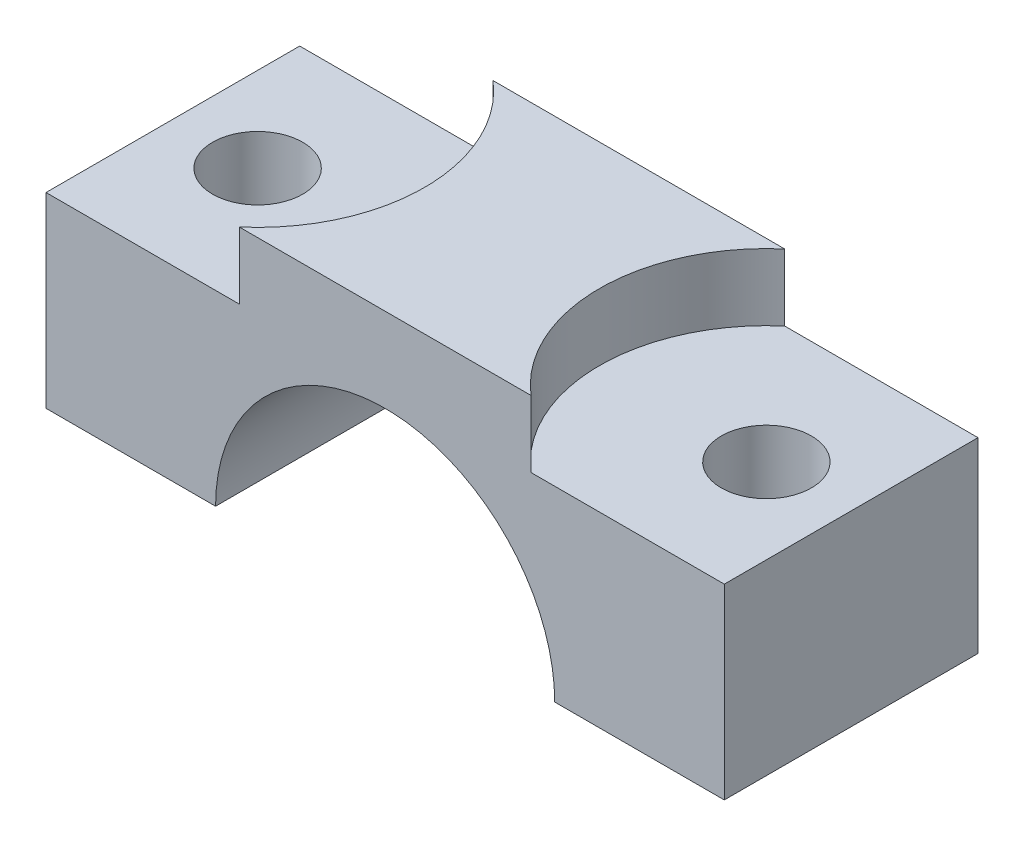
from build123d import *

# Parameters (mm, degrees)
BOSS_EXTRUDE1_DEPTH                           = 9.5
CBORE_FOR_M12_HEX_HEAD_CAP_SCREW2_D           = 6.75
CBORE_FOR_M12_HEX_HEAD_CAP_SCREW2_CBORE_D     = 25
CBORE_FOR_M12_HEX_HEAD_CAP_SCREW2_CBORE_DEPTH = 5


with BuildPart() as part:
    # Sketch1 → Boss-Extrude1 (new, symmetric)
    with BuildSketch(Plane.XY):
        with BuildLine():
            Line((12.7, 0), (25.4, 0))
            Line((25.4, 0), (25.4, 19))
            Line((25.4, 19), (-25.4, 19))
            Line((-25.4, 19), (-25.4, 0))
            Line((-25.4, 0), (-12.7, 0))
            ThreePointArc((-12.7, 0), (0, 12.7), (12.7, 0))
        make_face()
    extrude(amount=BOSS_EXTRUDE1_DEPTH, both=True)

    # CBORE for M12 Hex Head Cap Screw2 (through all)
    with Locations(Plane(origin=(0, 19, 0), x_dir=(1, 0, 0), z_dir=(0, 1, 0))):
        with Locations((-19.05, 0), (19.05, 0)):
            CounterBoreHole(CBORE_FOR_M12_HEX_HEAD_CAP_SCREW2_D / 2, CBORE_FOR_M12_HEX_HEAD_CAP_SCREW2_CBORE_D / 2, CBORE_FOR_M12_HEX_HEAD_CAP_SCREW2_CBORE_DEPTH)


solid = part.part
